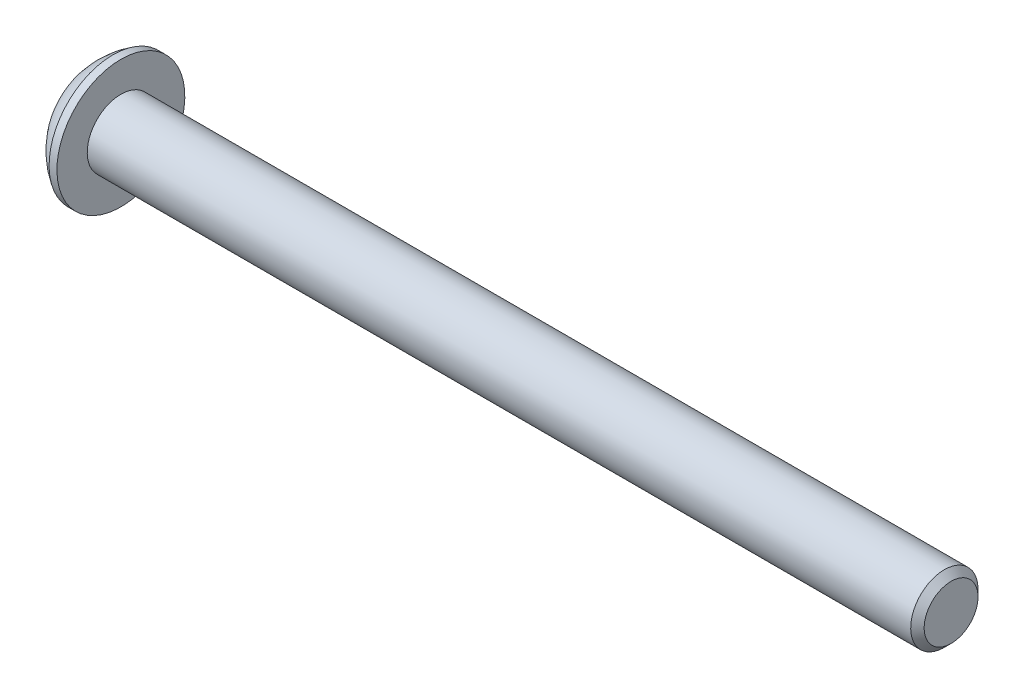
from build123d import *

# Parameters (mm, degrees)
ENL_V_MAT_EXTRU_1_DEPTH = 1


with BuildPart() as part:
    # Esquisse2 → Révolution1 (revolve)
    with BuildSketch(Plane.XY):
        with BuildLine():
            Line((0, 0), (0, 1.425))
            ThreePointArc((0, 1.425), (0.545219548, 2.233089184), (1.3, 2.85))
            Line((1.3, 2.85), (1.65, 2.85))
            Line((1.65, 2.85), (1.65, 1.5))
            Line((1.65, 1.5), (38.35, 1.5))
            Line((38.35, 1.5), (38.65, 1.2))
            Line((38.65, 1.2), (38.65, 0))
            Line((38.65, 0), (0, 0))
        make_face()
    revolve(axis=Axis((38.65, 0, 0), (-1, 0, 0)))

    # Esquisse3 → Enlèv. mat.-Extru.1 (cut)
    with BuildSketch(Plane.ZY):
        Polygon((0, 1.154700538), (-1, 0.577350269), (-1, -0.577350269), (0, -1.154700538), (1, -0.577350269), (1, 0.577350269), align=None)
    extrude(amount=-ENL_V_MAT_EXTRU_1_DEPTH, mode=Mode.SUBTRACT)


solid = part.part
